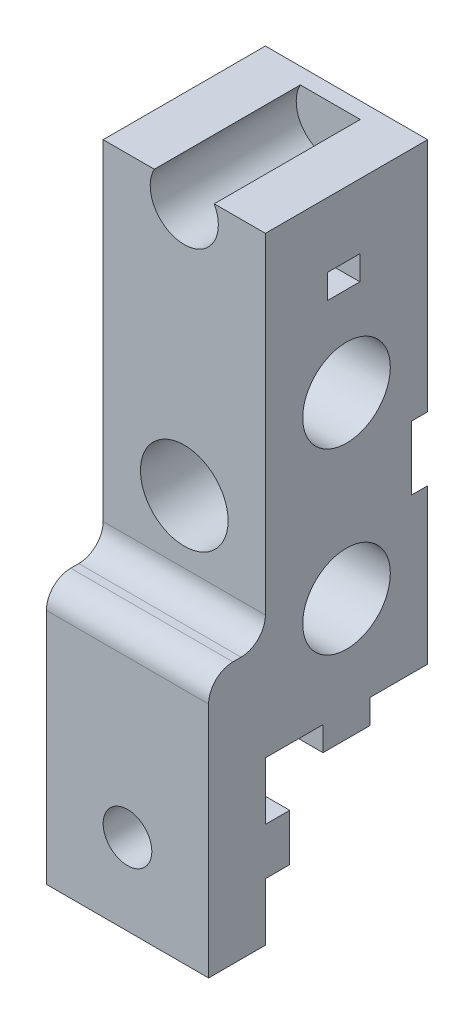
from build123d import *

# Parameters (mm, degrees)
SKETCH24_R          = 5.4
SKETCH24_W          = 4
SKETCH24_H          = 3
BOSS_EXTRUDE1_DEPTH = 20
SKETCH28_W          = 7
SKETCH28_H          = 32.25
BOSS_EXTRUDE2_DEPTH = 20
SKETCH25_R          = 5.4
CUT_EXTRUDE1_DEPTH  = 20
SKETCH26_R          = 4.2
CUT_EXTRUDE2_DEPTH  = 18
SKETCH27_R          = 10.75
CUT_EXTRUDE3_DEPTH  = 2
FILLET4_R           = 3
FILLET6_R           = 3
SKETCH31_R          = 3
CUT_EXTRUDE5_DEPTH  = 7
SKETCH32_W          = 3
SKETCH32_H          = 5.8
BOSS_EXTRUDE3_DEPTH = 3


with BuildPart() as part:
    # Sketch24 → Boss-Extrude1 (new body)
    with BuildSketch(Plane(origin=(0, 0, 0), x_dir=(0, 0, -1), z_dir=(1, 0, 0))):
        Polygon((10, -9.157855987), (10, 46.842144013), (-10, 46.842144013), (-10, -9.157855987), (-2.9, -9.157855987), (-2.9, -12.157855987), (2.9, -12.157855987), (2.9, -9.157855987), align=None)
        with Locations((0, 24.842144013)):
            Circle(SKETCH24_R, mode=Mode.SUBTRACT)
        with Locations((0, 2.842144013)):
            Circle(SKETCH24_R, mode=Mode.SUBTRACT)
        with Locations((-0.353280434, 37.342144013)):
            Rectangle(SKETCH24_W, SKETCH24_H, mode=Mode.SUBTRACT)
    extrude(amount=BOSS_EXTRUDE1_DEPTH)

    # Sketch28 → Boss-Extrude2 (add)
    with BuildSketch(Plane(origin=(20, 0, 0), x_dir=(0, 0, -1), z_dir=(1, 0, 0))):
        with Locations((-13.5, -13.032855987)):
            Rectangle(SKETCH28_W, SKETCH28_H)
    extrude(amount=-BOSS_EXTRUDE2_DEPTH)

    # Sketch25 → Cut-Extrude1 (cut)
    with BuildSketch(Plane.XY.offset(10)):
        with Locations((10, 13.842144013)):
            Circle(SKETCH25_R)
    extrude(amount=-CUT_EXTRUDE1_DEPTH, mode=Mode.SUBTRACT)

    # Sketch26 → Cut-Extrude2 (cut)
    with BuildSketch(Plane.XY.offset(10)):
        with Locations((10, 44.842144013)):
            Circle(SKETCH26_R)
    extrude(amount=-CUT_EXTRUDE2_DEPTH, mode=Mode.SUBTRACT)

    # Sketch27 → Cut-Extrude3 (cut)
    with BuildSketch(Plane(origin=(0, 0, -10), x_dir=(-1, 0, 0), z_dir=(0, 0, -1))):
        with Locations((-10, 13.842144013)):
            Circle(SKETCH27_R)
    extrude(amount=-CUT_EXTRUDE3_DEPTH, mode=Mode.SUBTRACT)

    # Fillet4
    fillet4_edges = [part.edges().sort_by_distance(p)[0] for p in [
        (10, 3.092144013, 17),
    ]]
    fillet(fillet4_edges, radius=FILLET4_R)

    # Fillet6
    fillet6_edges = [part.edges().sort_by_distance(p)[0] for p in [
        (10, 3.092144013, 10),
    ]]
    fillet(fillet6_edges, radius=FILLET6_R)

    # Sketch31 → Cut-Extrude5 (cut)
    with BuildSketch(Plane.XY.offset(17)):
        with Locations((10, -19.157855987)):
            Circle(SKETCH31_R)
    extrude(amount=-CUT_EXTRUDE5_DEPTH, mode=Mode.SUBTRACT)

    # Sketch32 → Boss-Extrude3 (add)
    with BuildSketch(Plane(origin=(0, 0, 10), x_dir=(-1, 0, 0), z_dir=(0, 0, -1))):
        with Locations((-1.5, -19.157855987)):
            Rectangle(SKETCH32_W, SKETCH32_H)
        with Locations((-18.5, -19.157855987)):
            Rectangle(SKETCH32_W, SKETCH32_H)
    extrude(amount=BOSS_EXTRUDE3_DEPTH)


solid = part.part
